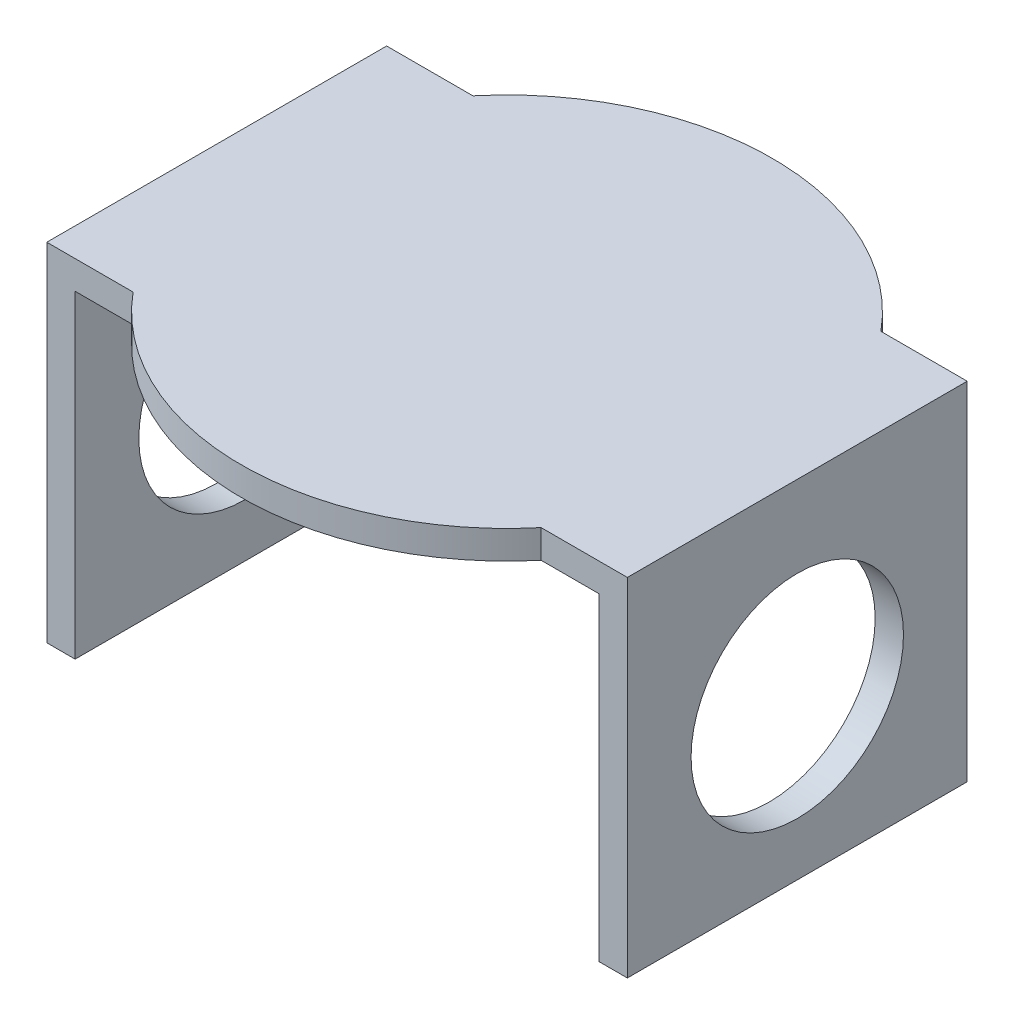
from build123d import *

# Parameters (mm, degrees)
EXTRUDE_1_DEPTH     = 96
SKETCH_2_R          = 30
CUT_EXTRUDE_1_DEPTH = 172
SKETCH_3_R          = 75
EXTRUDE_2_DEPTH     = 8


with BuildPart() as part:
    # 草图1 → 凸台-拉伸1 (new body)
    with BuildSketch(Plane.XY):
        Polygon((-82, 98), (82, 98), (82, 0), (74, 0), (74, 90), (-74, 90), (-74, 0), (-82, 0), align=None)
    extrude(amount=EXTRUDE_1_DEPTH)

    # 草图2 → 切除-拉伸1 (cut)
    with BuildSketch(Plane(origin=(82, 0, 0), x_dir=(0, 0, -1), z_dir=(1, 0, 0))):
        with Locations(Location((-48, 45, 0), (0, 0, 90))):
            Circle(SKETCH_2_R)
    extrude(amount=-CUT_EXTRUDE_1_DEPTH, mode=Mode.SUBTRACT)

    # 草图3 → 凸台-拉伸2 (add)
    with BuildSketch(Plane(origin=(0, 98, 0), x_dir=(1, 0, 0), z_dir=(0, 1, 0))):
        with Locations((0, -48)):
            Circle(SKETCH_3_R)
    extrude(amount=-EXTRUDE_2_DEPTH)


solid = part.part
